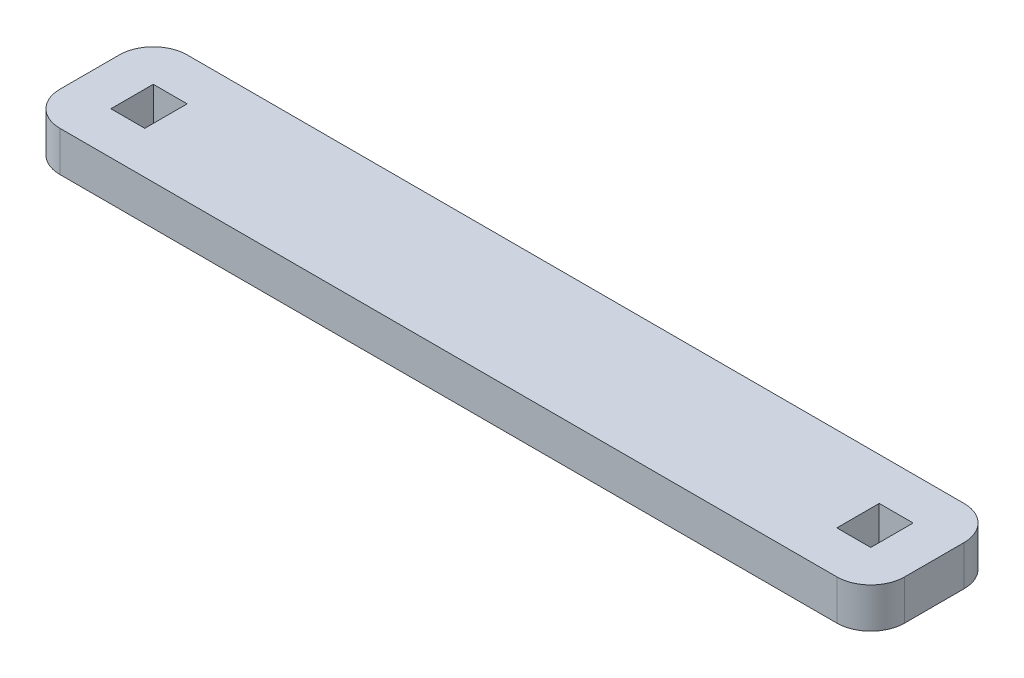
from build123d import *

# Parameters (mm, degrees)
SKETCH1_W           = 63.246
SKETCH1_H           = 9.525
SKETCH1_W_2         = 2.54
SKETCH1_H_2         = 3.175
BOSS_EXTRUDE1_DEPTH = 1.5
FILLET1_R           = 2.54


with BuildPart() as part:
    # Sketch1 → Boss-Extrude1 (new, symmetric)
    with BuildSketch(Plane(origin=(0, 0, 0), x_dir=(1, 0, 0), z_dir=(0, 1, 0))):
        Rectangle(SKETCH1_W, SKETCH1_H)
        with Locations((-27.178, 0)):
            Rectangle(SKETCH1_W_2, SKETCH1_H_2, mode=Mode.SUBTRACT)
        with Locations((27.178, 0)):
            Rectangle(SKETCH1_W_2, SKETCH1_H_2, mode=Mode.SUBTRACT)
    extrude(amount=BOSS_EXTRUDE1_DEPTH, both=True)

    # Fillet1
    fillet1_edges = [part.edges().sort_by_distance(p)[0] for p in [
        (-31.623, 0, -4.7625),
        (31.623, 0, -4.7625),
        (31.623, 0, 4.7625),
        (-31.623, 0, 4.7625),
    ]]
    fillet(fillet1_edges, radius=FILLET1_R)


solid = part.part
